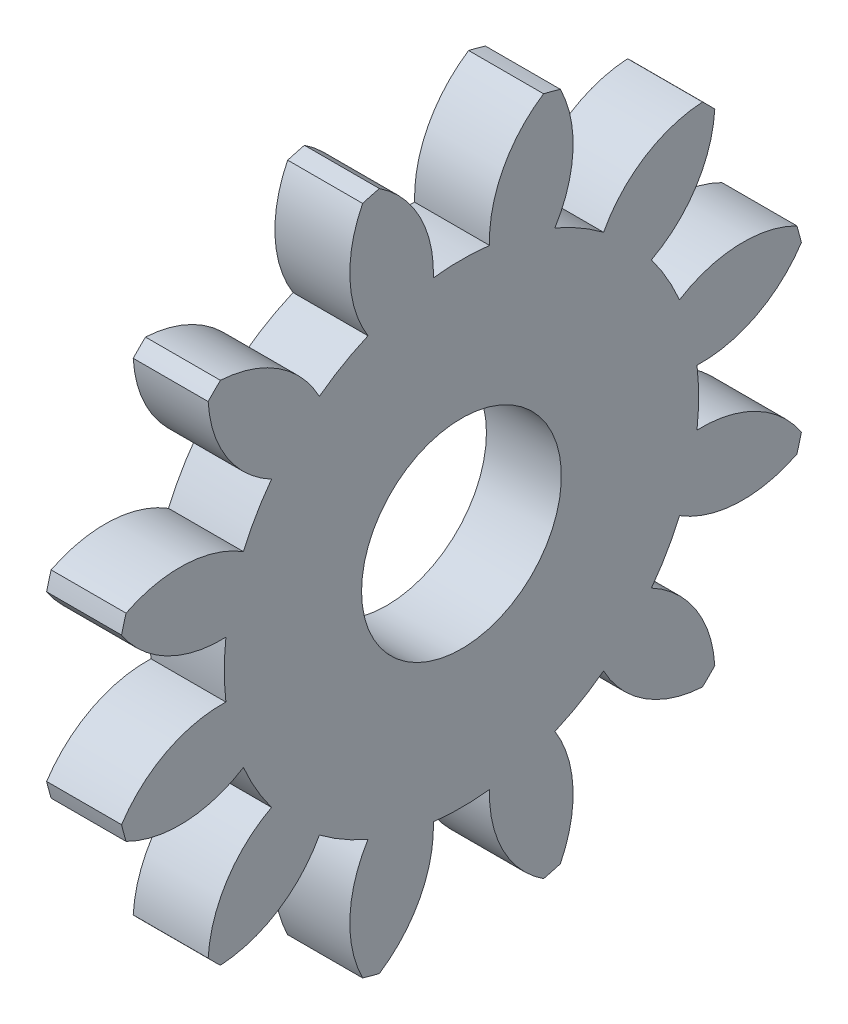
from build123d import *

# Parameters (mm, degrees)
BASPROSKE_W     = 1.5
BASPROSKE_H     = 7
TOOTHCUT_DEPTH  = 11.012492197
TEETHCUTS_COUNT = 12
TEETHCUTS_ANGLE = 330
BORSKE_R        = 2
BORE_DEPTH      = 50.0000508


with BuildPart() as part:
    # BasProSke → Base-Revolve (revolve)
    with BuildSketch(Plane(origin=(0, 0, 0), x_dir=(1, 0, 0), z_dir=(0, 1, 0)), mode=Mode.PRIVATE) as base_revolve_sk:
        with Locations((0.75, 3.5)):
            Rectangle(BASPROSKE_W, BASPROSKE_H)
    revolve(base_revolve_sk.sketch.rotate(Axis((-10, 0, 0), (1, 0, 0)), 180), axis=Axis((-10, 0, 0), (1, 0, 0)))

    # TooCutSke → ToothCut (cut, through all)
    with BuildSketch(Plane(origin=(0, 0, 0), x_dir=(0, 0, -1), z_dir=(1, 0, 0))):
        with BuildLine():
            ThreePointArc((0.562207301, 4.715604304), (0, 4.749), (-0.562207301, 4.715604304))
            ThreePointArc((-0.562207301, 4.715604304), (-0.837528627, 5.917009812), (-1.672850686, 6.823328788))
            ThreePointArc((-1.672850686, 6.823328788), (0, 7.0254), (1.672850686, 6.823328788))
            ThreePointArc((1.672850686, 6.823328788), (0.837528627, 5.917009812), (0.562207301, 4.715604304))
        make_face()
    toothcut = extrude(amount=TOOTHCUT_DEPTH, mode=Mode.SUBTRACT)

    # TeethCuts: ToothCut ×12 about axis
    teethcuts_axis = Axis((-10, 0, 0), (1, 0, 0))
    for i in range(1, TEETHCUTS_COUNT):
        add(toothcut.rotate(teethcuts_axis, i * TEETHCUTS_ANGLE / (TEETHCUTS_COUNT - 1)), mode=Mode.SUBTRACT)

    # BorSke → Bore (cut, symmetric)
    with BuildSketch(Plane(origin=(0, 0, 0), x_dir=(0, 0, -1), z_dir=(1, 0, 0))):
        with Locations(Location((0, 0, 0), (0, 0, 180))):
            Circle(BORSKE_R)
    extrude(amount=BORE_DEPTH, both=True, mode=Mode.SUBTRACT)


solid = part.part
